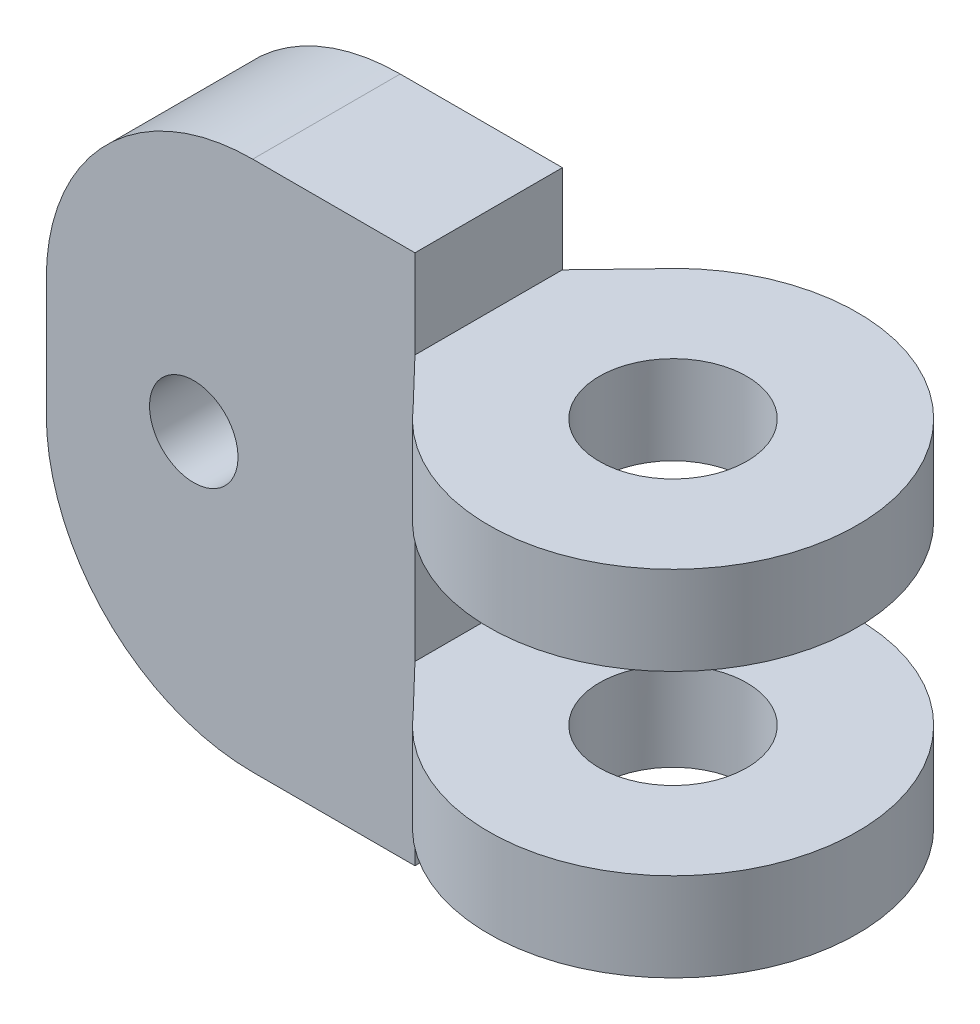
from build123d import *
from build123d.topology import SkipClean

# Parameters (mm, degrees)
CROQUIS1_R              = 1.5
SALIENTE_EXTRUIR1_DEPTH = 15
CROQUIS2_R              = 2.5
CORTAR_EXTRUIR1_DEPTH   = 20
CORTAR_EXTRUIR2_START   = -26
CROQUIS4_W              = 5.5
CROQUIS4_H              = 5
CORTAR_EXTRUIR2_DEPTH   = 26


with BuildPart() as part:
    # Croquis1 → Saliente-Extruir1 (new body)
    with BuildSketch(Plane.XY):
        with BuildLine():
            Line((11.25, 17.1), (11.25, 14.1))
            Line((11.25, 14.1), (23.75, 14.1))
            Line((23.75, 14.1), (23.75, 11.1))
            Line((23.75, 11.1), (11.25, 11.1))
            Line((11.25, 11.1), (11.25, 5.1))
            Line((11.25, 5.1), (23.75, 5.1))
            Line((23.75, 5.1), (23.75, 2.1))
            Line((23.75, 2.1), (11.25, 2.1))
            Line((11.25, 2.1), (11.25, -0.9))
            Line((11.25, -0.9), (5.75, -0.9))
            ThreePointArc((5.75, -0.9), (0.800252532, 1.150252532), (-1.25, 6.1))
            Line((-1.25, 6.1), (-1.25, 10.1))
            ThreePointArc((-1.25, 10.1), (0.800252532, 15.049747468), (5.75, 17.1))
            Line((5.75, 17.1), (11.25, 17.1))
        make_face()
        with Locations((3.75, 8.1)):
            Circle(CROQUIS1_R, mode=Mode.SUBTRACT)
    extrude(amount=SALIENTE_EXTRUIR1_DEPTH)

    # Croquis2 → Cortar-Extruir1 (cut)
    with BuildSketch(Plane(origin=(0, 0, 0), x_dir=(1, 0, 0), z_dir=(0, 1, 0))):
        with Locations((17.5, -7.5)):
            Circle(CROQUIS2_R)
        with BuildLine():
            Line((17.5, -1.25), (11.25, 0))
            Line((11.25, 0), (11.126279301, 1.868603497))
            Line((11.126279301, 1.868603497), (29.663453957, 1.868603497))
            Line((29.663453957, 1.868603497), (29.663453957, -17.961269996))
            Line((29.663453957, -17.961269996), (11.25, -17.961269996))
            Line((11.25, -17.961269996), (11.25, -15))
            Line((11.25, -15), (17.5, -13.75))
            ThreePointArc((17.5, -13.75), (23.75, -7.5), (17.5, -1.25))
        make_face()
    extrude(amount=CORTAR_EXTRUIR1_DEPTH, mode=Mode.SUBTRACT)

    # Croquis4 → Cortar-Extruir2 (cut)
    with SkipClean():  # the faces are left unmerged after this step: merging them gives an invalid solid
        with BuildSketch(Plane(origin=(0, 17.1, 0), x_dir=(1, 0, 0), z_dir=(0, 1, 0)).offset(CORTAR_EXTRUIR2_START)):
            with BuildLine():
                Line((-4.389645589, -5), (5.75, -5))
                Line((5.75, -5), (5.75, 0))
                Line((5.75, 0), (11.25, 0))
                Line((11.25, 0), (11.25, -5))
                Line((11.25, -5), (12.730653795, -3.460713334))
                ThreePointArc((12.730653795, -3.460713334), (12.995627449, -3.167203221), (13.278631189, -2.891036411))
                ThreePointArc((13.278631189, -2.891036411), (15.2354385, -1.674687887), (17.5, -1.25))
                Line((17.5, -1.25), (17.5, 1.887707064))
                Line((17.5, 1.887707064), (-4.389645589, 1.887707064))
                Line((-4.389645589, 1.887707064), (-4.389645589, -5))
            make_face()
            with Locations((8.5, -2.5)):
                Rectangle(CROQUIS4_W, CROQUIS4_H)
            with BuildLine():
                Line((5.75, -10), (-4.389645589, -10))
                Line((-4.389645589, -10), (-4.389645589, -16.45653889))
                Line((-4.389645589, -16.45653889), (17.5, -16.45653889))
                Line((17.5, -16.45653889), (17.5, -13.75))
                ThreePointArc((17.5, -13.75), (14.878268112, -13.173536984), (12.740162296, -11.550487011))
                Line((12.740162296, -11.550487011), (11.25, -10))
                Line((11.25, -10), (11.25, -15))
                Line((11.25, -15), (5.75, -15))
                Line((5.75, -15), (5.75, -10))
            make_face()
            with Locations((8.5, -12.5)):
                Rectangle(CROQUIS4_W, CROQUIS4_H)
        extrude(amount=CORTAR_EXTRUIR2_DEPTH, mode=Mode.SUBTRACT)


solid = part.part
